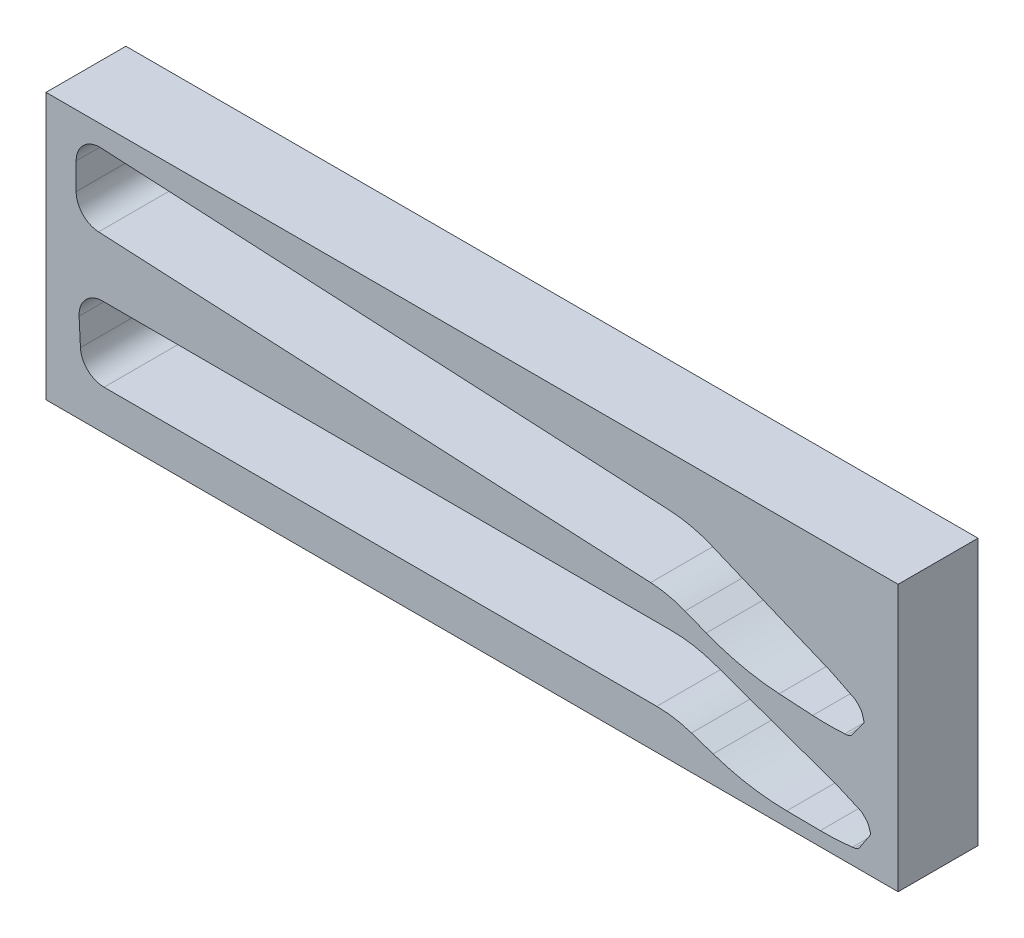
from build123d import *

# Parameters (mm, degrees)
SKETCH1_W           = 32
SKETCH1_H           = 10
BOSS_EXTRUDE1_DEPTH = 3


with BuildPart() as part:
    # Sketch1 → Boss-Extrude1 (new body)
    with BuildSketch(Plane.XY):
        Rectangle(SKETCH1_W, SKETCH1_H)
        with BuildLine():
            Line((7.508183749, -0.761607487), (-13.867203265, -0.724177951))
            ThreePointArc((-13.867203265, -0.724177951), (-14.512395102, -0.999943521), (-14.756643634, -1.657713853))
            Line((-14.756643634, -1.657713853), (-14.706591665, -2.655537266))
            ThreePointArc((-14.706591665, -2.655537266), (-14.431377295, -3.255171805), (-13.818707983, -3.5))
            Line((-13.818707983, -3.5), (6.937095785, -3.5))
            ThreePointArc((6.937095785, -3.5), (7.597596174, -3.554033013), (8.240533164, -3.714695258))
            Line((8.240533164, -3.714695258), (9.052328165, -3.989582288))
            ThreePointArc((9.052328165, -3.989582288), (10.41628769, -4.333930654), (11.817489406, -4.458811135))
            Line((11.817489406, -4.458811135), (13.078294798, -4.471023796))
            ThreePointArc((13.078294798, -4.471023796), (13.681851068, -4.457737599), (14.283353389, -4.406243399))
            Line((14.283353389, -4.406243399), (14.372039696, -4.395810789))
            ThreePointArc((14.372039696, -4.395810789), (14.475481789, -4.359873847), (14.554181178, -4.28372835))
            Line((14.554181178, -4.28372835), (14.962805958, -3.66627609))
            ThreePointArc((14.962805958, -3.66627609), (14.970850873, -3.64453799), (14.968401274, -3.621488801))
            Line((14.968401274, -3.621488801), (14.889319766, -3.39508526))
            ThreePointArc((14.889319766, -3.39508526), (14.851890355, -3.317474793), (14.797978781, -3.25025956))
            Line((14.797978781, -3.25025956), (14.680939758, -3.134135777))
            ThreePointArc((14.680939758, -3.134135777), (14.626648009, -3.089415012), (14.565060551, -3.055436699))
            Line((14.565060551, -3.055436699), (13.68837555, -2.672614052))
            Line((13.68837555, -2.672614052), (9.097693662, -1.037644589))
            ThreePointArc((9.097693662, -1.037644589), (8.314712232, -0.83183031), (7.508183749, -0.761607487))
        make_face(mode=Mode.SUBTRACT)
        with BuildLine():
            Line((7.413496434, 3.116023179), (-13.933174328, 4.224273311))
            ThreePointArc((-13.933174328, 4.224273311), (-14.591371345, 3.981176945), (-14.868266258, 3.336468978))
            Line((-14.868266258, 3.336468978), (-14.868266258, 2.337391022))
            ThreePointArc((-14.868266258, 2.337391022), (-14.623438064, 1.724721711), (-14.023803524, 1.449507341))
            Line((-14.023803524, 1.449507341), (6.705937155, 0.409679726))
            ThreePointArc((6.705937155, 0.409679726), (7.362901198, 0.322624707), (7.996981968, 0.129954245))
            Line((7.996981968, 0.129954245), (8.793986262, -0.185257046))
            ThreePointArc((8.793986262, -0.185257046), (10.138981841, -0.597504878), (11.532167784, -0.792426178))
            Line((11.532167784, -0.792426178), (12.790778149, -0.867787535))
            ThreePointArc((12.790778149, -0.867787535), (13.394242147, -0.884755081), (13.997568925, -0.863459703))
            Line((13.997568925, -0.863459703), (14.086666523, -0.857483214))
            ThreePointArc((14.086666523, -0.857483214), (14.191779099, -0.826773657), (14.274194414, -0.754666471))
            Line((14.274194414, -0.754666471), (14.713239307, -0.158460897))
            ThreePointArc((14.713239307, -0.158460897), (14.722363159, -0.137153129), (14.721071357, -0.114010163))
            Line((14.721071357, -0.114010163), (14.653431554, 0.116070922))
            ThreePointArc((14.653431554, 0.116070922), (14.619937284, 0.195459078), (14.569460767, 0.265290779))
            Line((14.569460767, 0.265290779), (14.458386298, 0.387132185))
            ThreePointArc((14.458386298, 0.387132185), (14.406403152, 0.434516711), (14.34659528, 0.471537776))
            Line((14.34659528, 0.471537776), (13.490189844, 0.897800019))
            Line((13.490189844, 0.897800019), (8.987181446, 2.760701173))
            ThreePointArc((8.987181446, 2.760701173), (8.215494123, 3.00548294), (7.413496434, 3.116023179))
        make_face(mode=Mode.SUBTRACT)
    extrude(amount=BOSS_EXTRUDE1_DEPTH)


solid = part.part
